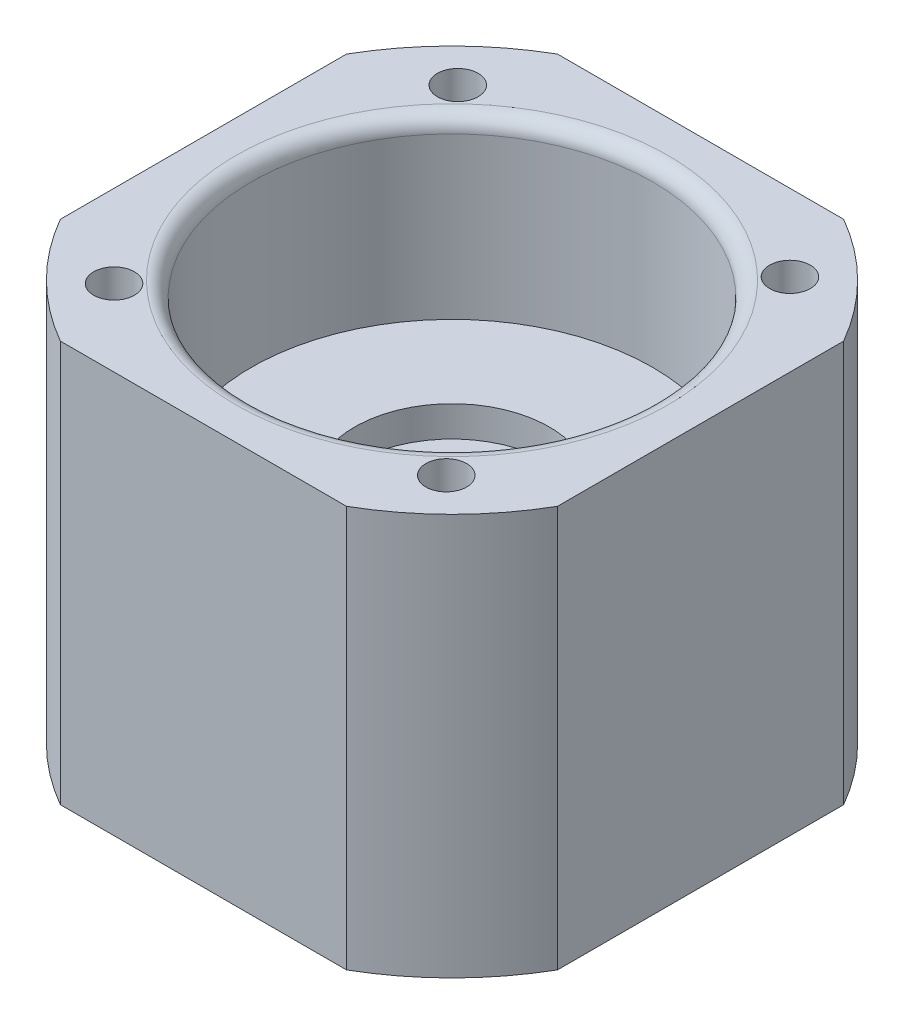
from build123d import *

# Parameters (mm, degrees)
CUT_EXTRUDE2_DEPTH        = 38.909021354
CUT_EXTRUDE2_DEPTH_BACK   = 38.909021354
SKETCH4_OUTSIDE_W         = 52.124
SKETCH4_OUTSIDE_H         = 52.124
SKETCH4_OUTSIDE_W_2       = 33.02
SKETCH4_OUTSIDE_H_2       = 33.02
F_6_32_TAPPED_HOLE2_D     = 2.7051
F_6_32_TAPPED_HOLE2_DEPTH = 9.398
F_6_32_TAPPED_HOLE2_TIP   = 0.81269403
FILLET1_R                 = 1.016


with BuildPart() as part:
    # Vent Valve Body Profile → Revolve2 (revolve)
    with BuildSketch(Plane.XY, mode=Mode.PRIVATE) as revolve2_sk:
        Polygon((-19.05, 26.67), (-19.05, 0), (-4.445, 0), (-4.445, 3.302), (-2.794, 3.302), (-2.794, 12.954), (-6.477, 12.954), (-6.477, 14.986), (-13.335, 14.986), (-13.335, 26.67), align=None)
    revolve(revolve2_sk.sketch.rotate(Axis((0, 11.135829036, 0), (0, -1, 0)), 270), axis=Axis((0, 11.135829036, 0), (0, -1, 0)))

    # Sketch4 outside → Cut-Extrude2 (cut, two sides: drawn at the far end of the back side and taken through both)
    with BuildSketch(Plane(origin=(0, 26.67, 0), x_dir=(1, 0, 0), z_dir=(0, 1, 0)).offset(-CUT_EXTRUDE2_DEPTH_BACK)):
        Rectangle(SKETCH4_OUTSIDE_W, SKETCH4_OUTSIDE_H)
        Rectangle(SKETCH4_OUTSIDE_W_2, SKETCH4_OUTSIDE_H_2, mode=Mode.SUBTRACT)
    extrude(amount=CUT_EXTRUDE2_DEPTH + CUT_EXTRUDE2_DEPTH_BACK, mode=Mode.SUBTRACT)

    # #6-32 Tapped Hole2
    with Locations(Plane(origin=(0, 26.67, 0), x_dir=(1, 0, 0), z_dir=(0, 1, 0))):
        with Locations((11.032567234, 11.414818668), (11.032567234, -11.414818668), (-11.032567234, -11.414818668), (-11.032567234, 11.414818668)):
            Hole(F_6_32_TAPPED_HOLE2_D / 2, depth=F_6_32_TAPPED_HOLE2_DEPTH)
            with Locations((0, 0, -(F_6_32_TAPPED_HOLE2_DEPTH + F_6_32_TAPPED_HOLE2_TIP / 2))):  # 118° drill point
                Cone(0, F_6_32_TAPPED_HOLE2_D / 2, F_6_32_TAPPED_HOLE2_TIP, mode=Mode.SUBTRACT)

    # Fillet1
    fillet1_edges = [part.edges().sort_by_distance(p)[0] for p in [
        (0, 26.67, -13.335),
    ]]
    fillet(fillet1_edges, radius=FILLET1_R)


solid = part.part
